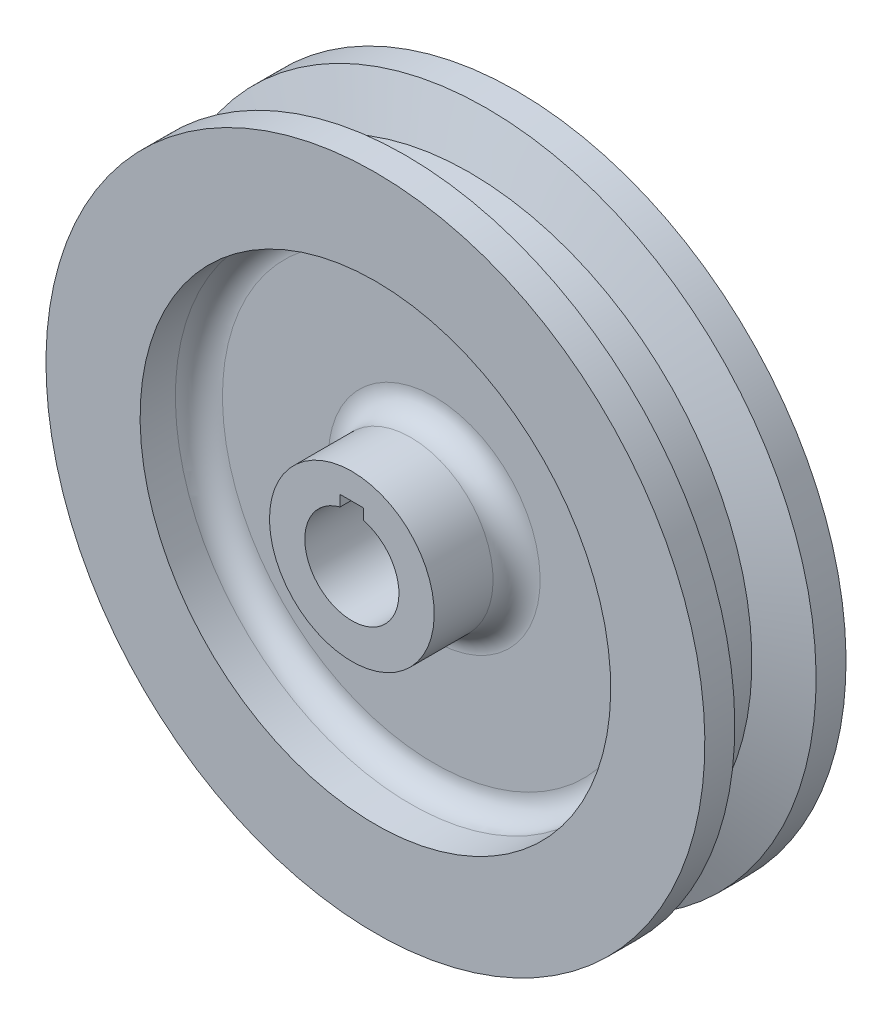
from build123d import *

# Parameters (mm, degrees)
SKETCH2_W          = 6.35
SKETCH2_H          = 15.24
CUT_EXTRUDE1_DEPTH = 136.598893801


with BuildPart() as part:
    # Sketch1 → Revolve1 (revolve)
    with BuildSketch(Plane(origin=(0, 0, 0), x_dir=(0, 0, -1), z_dir=(1, 0, 0))):
        with BuildLine():
            Line((9.525, 63.5), (19.05, 63.5))
            Line((19.05, 63.5), (19.05, 88.9))
            Line((19.05, 88.9), (10.972421975, 88.9))
            Line((10.972421975, 88.9), (6.35, 76.2))
            Line((6.35, 76.2), (-6.35, 76.2))
            Line((-6.35, 76.2), (-10.972421975, 88.9))
            Line((-10.972421975, 88.9), (-19.05, 88.9))
            Line((-19.05, 88.9), (-19.05, 63.5))
            Line((-19.05, 63.5), (-9.525, 63.5))
            ThreePointArc((-9.525, 63.5), (-5.034871939, 61.640128061), (-3.175, 57.15))
            Line((-3.175, 57.15), (-3.175, 28.575))
            ThreePointArc((-3.175, 28.575), (-5.034871939, 24.084871939), (-9.525, 22.225))
            Line((-9.525, 22.225), (-25.4, 22.225))
            Line((-25.4, 22.225), (-25.4, 12.7))
            Line((-25.4, 12.7), (25.4, 12.7))
            Line((25.4, 12.7), (25.4, 22.225))
            Line((25.4, 22.225), (9.525, 22.225))
            ThreePointArc((9.525, 22.225), (5.034871939, 24.084871939), (3.175, 28.575))
            Line((3.175, 28.575), (3.175, 57.15))
            ThreePointArc((3.175, 57.15), (5.034871939, 61.640128061), (9.525, 63.5))
        make_face()
    revolve(axis=Axis((0, 0, 0), (0, 0, 1)))

    # Sketch2 → Cut-Extrude1 (cut, through all)
    with BuildSketch(Plane.XY.offset(25.4)):
        with Locations((0, 7.62)):
            Rectangle(SKETCH2_W, SKETCH2_H)
    extrude(amount=-CUT_EXTRUDE1_DEPTH, mode=Mode.SUBTRACT)


solid = part.part
